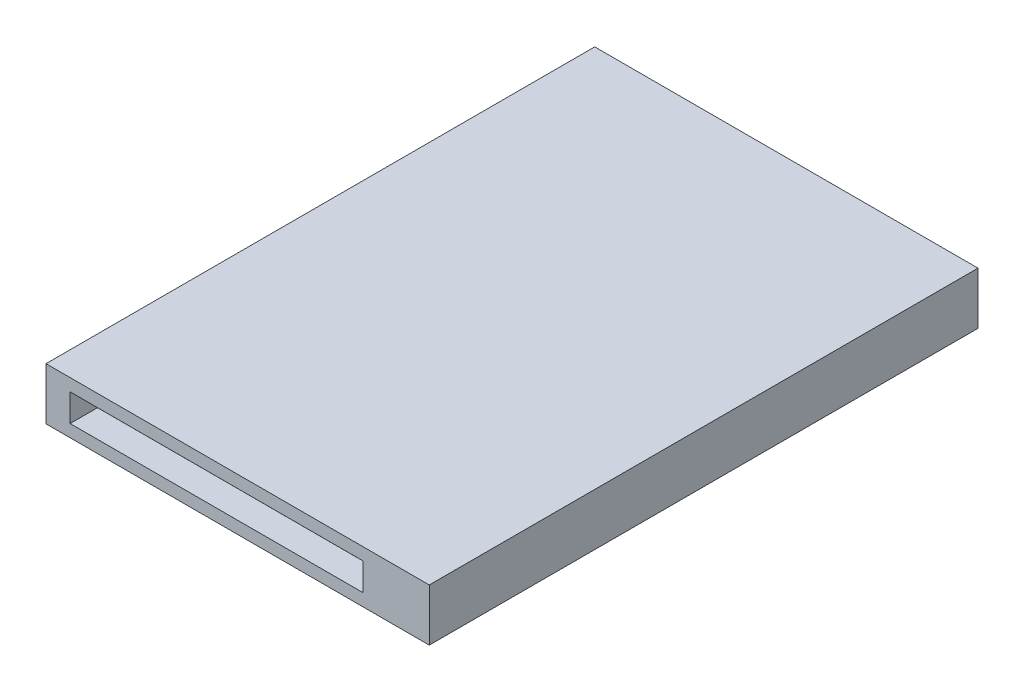
from build123d import *

# Parameters (mm, degrees)
SKICA1_W                 = 69.85
SKICA1_H                 = 100
P_IDAT_VYSUNUT_M1_DEPTH  = 9.5
SKICA2_W                 = 53.369088207
SKICA2_H                 = 5.007168458
ODEBRAT_VYSUNUT_M1_DEPTH = 5


with BuildPart() as part:
    # Skica1 → Přidat vysunutím1 (new body)
    with BuildSketch(Plane(origin=(0, 0, 0), x_dir=(1, 0, 0), z_dir=(0, 1, 0))):
        Rectangle(SKICA1_W, SKICA1_H)
    extrude(amount=P_IDAT_VYSUNUT_M1_DEPTH)

    # Skica2 → Odebrat vysunutím1 (cut)
    with BuildSketch(Plane.XY.offset(50)):
        with Locations((-3.846970889, 4.75)):
            Rectangle(SKICA2_W, SKICA2_H)
    extrude(amount=-ODEBRAT_VYSUNUT_M1_DEPTH, mode=Mode.SUBTRACT)


solid = part.part
